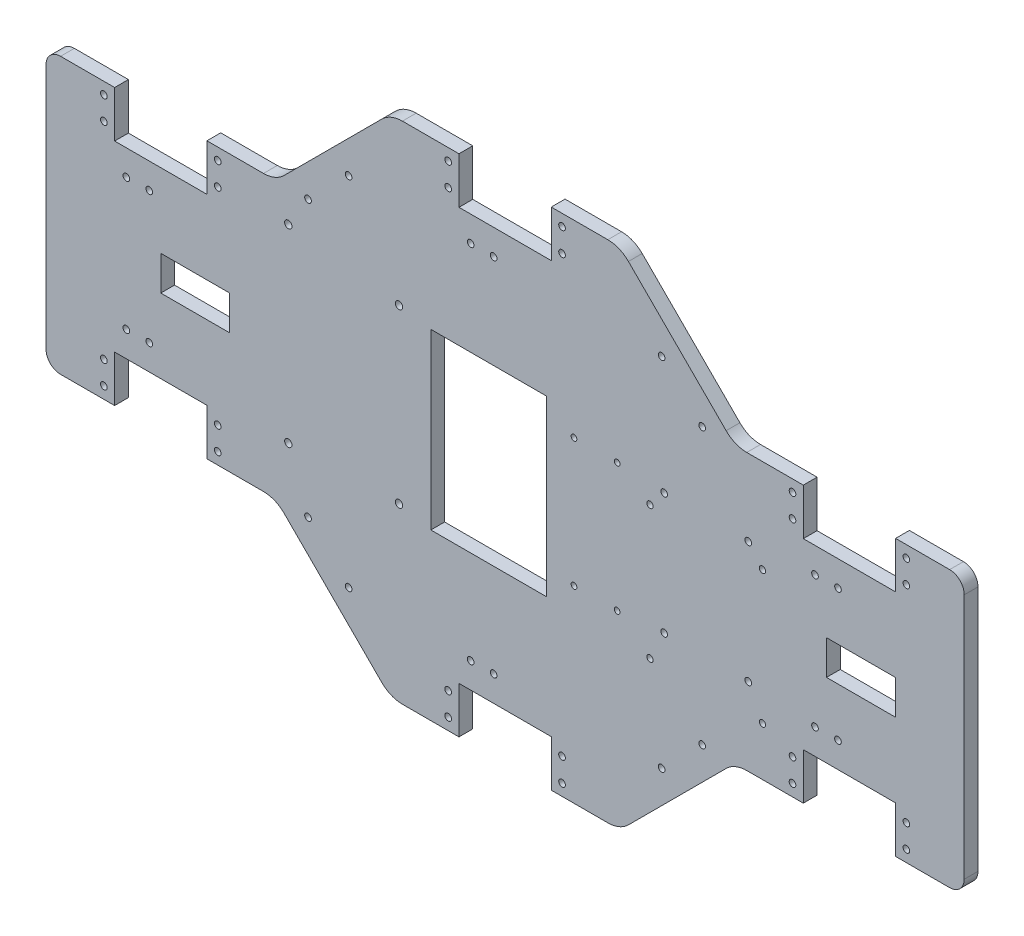
from build123d import *

# Parameters (mm, degrees)
BOSS_EXTRU_1_DEPTH       = 6
ENL_V_MAT_EXTRU_1_REACH  = 416.893
ESQUISSE2_W              = 40.2
ESQUISSE2_H              = 20.2
ENL_V_MAT_EXTRU_2_REACH  = 416.893
ESQUISSE3_R              = 1.45
SKETCH2_W                = 40.2
SKETCH2_H                = 20.2
CUT_EXTRUDE2_DEPTH       = 415.892757228
SKETCH5_R                = 1.45
CUT_EXTRUDE4_DEPTH       = 415.892757228
ESQUISSE4_R              = 1.375
ENL_V_MAT_EXTRU_4_DEPTH  = 415.892757228
ESQUISSE6_R              = 1.45
ENL_V_MAT_EXTRU_6_DEPTH  = 415.892757228
ESQUISSE8_R              = 1.25
ENL_V_MAT_EXTRU_7_DEPTH  = 415.892757228
ESQUISSE9_R              = 1.6
ENL_V_MAT_EXTRU_8_DEPTH  = 415.892757228
ESQUISSE10_W             = 50.45
ESQUISSE10_H             = 75.69
ENL_V_MAT_EXTRU_9_DEPTH  = 415.892757228
ESQUISSE11_W             = 30
ESQUISSE11_H             = 15
ENL_V_MAT_EXTRU_10_DEPTH = 415.892757228
ESQUISSE12_R             = 1.45
ENL_V_MAT_EXTRU_11_DEPTH = 415.892757228
FILLET1_R                = 6.35
FILLET2_R                = 12.7


with BuildPart() as part:
    # Esquisse1 → Boss.-Extru.1 (new body)
    with BuildSketch(Plane.XY):
        Polygon((100, -60), (150, -110), (250, -110), (300, -60), (400, -60), (400, 0), (25.838605695, 0), (0, 0), (0, -60), align=None)
    boss_extru_1 = extrude(amount=BOSS_EXTRU_1_DEPTH)

    # Esquisse2 → Enlèv. mat.-Extru.1 (cut, up to next)
    with BuildSketch(Plane.XY.offset(6), mode=Mode.PRIVATE) as enl_v_mat_extru_1_sk1:
        with Locations((50, -49.9)):
            Rectangle(ESQUISSE2_W, ESQUISSE2_H)
    enl_v_mat_extru_1_tool1 = extrude(enl_v_mat_extru_1_sk1.sketch, amount=-ENL_V_MAT_EXTRU_1_REACH, mode=Mode.PRIVATE) & part.part
    enl_v_mat_extru_1 = enl_v_mat_extru_1_tool1.solids().sort_by_distance((50, -49.9, 6))[0]
    add(enl_v_mat_extru_1, mode=Mode.SUBTRACT)

    # Esquisse3 → Enlèv. mat.-Extru.2 (cut, up to next)
    with BuildSketch(Plane.XY.offset(6), mode=Mode.PRIVATE) as enl_v_mat_extru_2_sk1:
        with Locations((25.2, -54.9)):
            Circle(ESQUISSE3_R)
    enl_v_mat_extru_2_tool1 = extrude(enl_v_mat_extru_2_sk1.sketch, amount=-ENL_V_MAT_EXTRU_2_REACH, mode=Mode.PRIVATE) & part.part
    # Esquisse3 → Enlèv. mat.-Extru.2 (cut, up to next)
    with BuildSketch(Plane.XY.offset(6), mode=Mode.PRIVATE) as enl_v_mat_extru_2_sk2:
        with Locations((74.8, -54.9)):
            Circle(ESQUISSE3_R)
    enl_v_mat_extru_2_tool2 = extrude(enl_v_mat_extru_2_sk2.sketch, amount=-ENL_V_MAT_EXTRU_2_REACH, mode=Mode.PRIVATE) & part.part
    # Esquisse3 → Enlèv. mat.-Extru.2 (cut, up to next)
    with BuildSketch(Plane.XY.offset(6), mode=Mode.PRIVATE) as enl_v_mat_extru_2_sk3:
        with Locations((74.8, -44.9)):
            Circle(ESQUISSE3_R)
    enl_v_mat_extru_2_tool3 = extrude(enl_v_mat_extru_2_sk3.sketch, amount=-ENL_V_MAT_EXTRU_2_REACH, mode=Mode.PRIVATE) & part.part
    # Esquisse3 → Enlèv. mat.-Extru.2 (cut, up to next)
    with BuildSketch(Plane.XY.offset(6), mode=Mode.PRIVATE) as enl_v_mat_extru_2_sk4:
        with Locations((25.2, -44.9)):
            Circle(ESQUISSE3_R)
    enl_v_mat_extru_2_tool4 = extrude(enl_v_mat_extru_2_sk4.sketch, amount=-ENL_V_MAT_EXTRU_2_REACH, mode=Mode.PRIVATE) & part.part
    # Esquisse3 → Enlèv. mat.-Extru.2 (cut, up to next)
    with BuildSketch(Plane.XY.offset(6), mode=Mode.PRIVATE) as enl_v_mat_extru_2_sk5:
        with Locations((35, -28.7)):
            Circle(ESQUISSE3_R)
    enl_v_mat_extru_2_tool5 = extrude(enl_v_mat_extru_2_sk5.sketch, amount=-ENL_V_MAT_EXTRU_2_REACH, mode=Mode.PRIVATE) & part.part
    # Esquisse3 → Enlèv. mat.-Extru.2 (cut, up to next)
    with BuildSketch(Plane.XY.offset(6), mode=Mode.PRIVATE) as enl_v_mat_extru_2_sk6:
        with Locations((45, -28.7)):
            Circle(ESQUISSE3_R)
    enl_v_mat_extru_2_tool6 = extrude(enl_v_mat_extru_2_sk6.sketch, amount=-ENL_V_MAT_EXTRU_2_REACH, mode=Mode.PRIVATE) & part.part
    enl_v_mat_extru_2_1 = enl_v_mat_extru_2_tool1.solids().sort_by_distance((25.2, -54.9, 6))[0]
    add(enl_v_mat_extru_2_1, mode=Mode.SUBTRACT)
    enl_v_mat_extru_2_2 = enl_v_mat_extru_2_tool2.solids().sort_by_distance((74.8, -54.9, 6))[0]
    add(enl_v_mat_extru_2_2, mode=Mode.SUBTRACT)
    enl_v_mat_extru_2_3 = enl_v_mat_extru_2_tool3.solids().sort_by_distance((74.8, -44.9, 6))[0]
    add(enl_v_mat_extru_2_3, mode=Mode.SUBTRACT)
    enl_v_mat_extru_2_4 = enl_v_mat_extru_2_tool4.solids().sort_by_distance((25.2, -44.9, 6))[0]
    add(enl_v_mat_extru_2_4, mode=Mode.SUBTRACT)
    enl_v_mat_extru_2_5 = enl_v_mat_extru_2_tool5.solids().sort_by_distance((35, -28.7, 6))[0]
    add(enl_v_mat_extru_2_5, mode=Mode.SUBTRACT)
    enl_v_mat_extru_2_6 = enl_v_mat_extru_2_tool6.solids().sort_by_distance((45, -28.7, 6))[0]
    add(enl_v_mat_extru_2_6, mode=Mode.SUBTRACT)
    enl_v_mat_extru_2 = enl_v_mat_extru_2_1 + enl_v_mat_extru_2_2 + enl_v_mat_extru_2_3 + enl_v_mat_extru_2_4 + enl_v_mat_extru_2_5 + enl_v_mat_extru_2_6  # Enlèv. mat.-Extru.2 as one shape, for the pattern or mirror that repeats it

    # Sketch2 → Cut-Extrude2 (cut, symmetric)
    with BuildSketch(Plane.XY):
        with Locations((350, -49.9)):
            Rectangle(SKETCH2_W, SKETCH2_H)
        with Locations((200, -99.9)):
            Rectangle(SKETCH2_W, SKETCH2_H)
    cut_extrude2 = extrude(amount=CUT_EXTRUDE2_DEPTH, both=True, mode=Mode.SUBTRACT)

    # Sketch5 → Cut-Extrude4 (cut, through all)
    with BuildSketch(Plane.XY):
        with Locations((175.200064516, -104.9)):
            Circle(SKETCH5_R)
        with Locations((224.8, -104.98)):
            Circle(SKETCH5_R)
        with Locations(Location((224.8, -94.82, 0), (0, 0, 180))):
            Circle(SKETCH5_R)
        with Locations(Location((175.200064516, -94.9, 0), (0, 0, 180))):
            Circle(SKETCH5_R)
        with Locations((325.2, -54.9)):
            Circle(SKETCH5_R)
        with Locations((374.8, -54.9)):
            Circle(SKETCH5_R)
        with Locations(Location((374.8, -44.9, 0), (0, 0, 180))):
            Circle(SKETCH5_R)
        with Locations(Location((325.2, -44.9, 0), (0, 0, 180))):
            Circle(SKETCH5_R)
        with Locations((185.000064516, -78.7)):
            Circle(SKETCH5_R)
        with Locations((195.000064516, -78.7)):
            Circle(SKETCH5_R)
        with Locations((335, -28.7)):
            Circle(SKETCH5_R)
        with Locations((345, -28.7)):
            Circle(SKETCH5_R)
    cut_extrude4 = extrude(amount=CUT_EXTRUDE4_DEPTH, mode=Mode.SUBTRACT)

    # Mirror1: Boss.-Extru.1, Enlèv. mat.-Extru.1, Enlèv. mat.-Extru.2, Cut-Extrude2, Cut-Extrude4 across plane
    add(boss_extru_1.mirror(Plane.ZX))
    add(enl_v_mat_extru_1.mirror(Plane.ZX), mode=Mode.SUBTRACT)
    add(enl_v_mat_extru_2.mirror(Plane.ZX), mode=Mode.SUBTRACT)
    add(cut_extrude2.mirror(Plane.ZX), mode=Mode.SUBTRACT)
    add(cut_extrude4.mirror(Plane.ZX), mode=Mode.SUBTRACT)

    # Esquisse4 → Enlèv. mat.-Extru.4 (cut, through all)
    with BuildSketch(Plane.XY.offset(6)):
        with Locations((263.1, -38.8)):
            Circle(ESQUISSE4_R)
        with Locations((312.1, -38.8)):
            Circle(ESQUISSE4_R)
        with Locations((312.1, 19.2)):
            Circle(ESQUISSE4_R)
        with Locations((263.1, 19.2)):
            Circle(ESQUISSE4_R)
    extrude(amount=-ENL_V_MAT_EXTRU_4_DEPTH, mode=Mode.SUBTRACT)

    # Esquisse6 → Enlèv. mat.-Extru.6 (cut, through all)
    with BuildSketch(Plane(origin=(0, 0, 0), x_dir=(-1, 0, 0), z_dir=(0, 0, -1))):
        with Locations((-269.29, -26.11)):
            Circle(ESQUISSE6_R)
        with Locations((-305.92, -26.11)):
            Circle(ESQUISSE6_R)
        with Locations((-305.92, 26.72)):
            Circle(ESQUISSE6_R)
        with Locations((-269.29, 26.72)):
            Circle(ESQUISSE6_R)
    extrude(amount=-ENL_V_MAT_EXTRU_6_DEPTH, mode=Mode.SUBTRACT)

    # Esquisse8 → Enlèv. mat.-Extru.7 (cut, through all)
    with BuildSketch(Plane(origin=(0, 0, 0), x_dir=(-1, 0, 0), z_dir=(0, 0, -1))):
        with Locations((-230, 27.95)):
            Circle(ESQUISSE8_R)
        with Locations((-248.8, 27.95)):
            Circle(ESQUISSE8_R)
        with Locations((-248.8, -27.95)):
            Circle(ESQUISSE8_R)
        with Locations((-230, -27.95)):
            Circle(ESQUISSE8_R)
    extrude(amount=-ENL_V_MAT_EXTRU_7_DEPTH, mode=Mode.SUBTRACT)

    # Esquisse9 → Enlèv. mat.-Extru.8 (cut, through all)
    with BuildSketch(Plane(origin=(0, 0, 0), x_dir=(-1, 0, 0), z_dir=(0, 0, -1))):
        with Locations((-153.75903462, -35.08)):
            Circle(ESQUISSE9_R)
        with Locations((-105.53903462, -36.31)):
            Circle(ESQUISSE9_R)
        with Locations((-105.53903462, 46.16)):
            Circle(ESQUISSE9_R)
        with Locations((-153.75903462, 39.8)):
            Circle(ESQUISSE9_R)
    extrude(amount=-ENL_V_MAT_EXTRU_8_DEPTH, mode=Mode.SUBTRACT)

    # Esquisse10 → Enlèv. mat.-Extru.9 (cut, through all)
    with BuildSketch(Plane(origin=(0, 0, 0), x_dir=(-1, 0, 0), z_dir=(0, 0, -1))):
        with Locations((-192.875, -0.205)):
            Rectangle(ESQUISSE10_W, ESQUISSE10_H)
    extrude(amount=-ENL_V_MAT_EXTRU_9_DEPTH, mode=Mode.SUBTRACT)

    # Esquisse11 → Enlèv. mat.-Extru.10 (cut, through all)
    with BuildSketch(Plane(origin=(0, 0, 0), x_dir=(-1, 0, 0), z_dir=(0, 0, -1))):
        with Locations((-355, 0)):
            Rectangle(ESQUISSE11_W, ESQUISSE11_H)
        with Locations((-65, 0)):
            Rectangle(ESQUISSE11_W, ESQUISSE11_H)
    extrude(amount=-ENL_V_MAT_EXTRU_10_DEPTH, mode=Mode.SUBTRACT)

    # Esquisse12 → Enlèv. mat.-Extru.11 (cut, through all)
    with BuildSketch(Plane.XY.offset(6)):
        with Locations((131.819805153, 77.67766953)):
            Circle(ESQUISSE12_R)
        with Locations((114.142135624, 60)):
            Circle(ESQUISSE12_R)
        with Locations(Location((285.857864376, 60, 0), (0, 0, 180))):
            Circle(ESQUISSE12_R)
        with Locations(Location((268.180194847, 77.67766953, 0), (0, 0, 180))):
            Circle(ESQUISSE12_R)
        with Locations((285.857864376, -60)):
            Circle(ESQUISSE12_R)
        with Locations((268.180194847, -77.67766953)):
            Circle(ESQUISSE12_R)
        with Locations(Location((131.819805153, -77.67766953, 0), (0, 0, 180))):
            Circle(ESQUISSE12_R)
        with Locations(Location((114.142135624, -60, 0), (0, 0, 180))):
            Circle(ESQUISSE12_R)
    extrude(amount=-ENL_V_MAT_EXTRU_11_DEPTH, mode=Mode.SUBTRACT)

    # Fillet1
    fillet1_edges = [part.edges().sort_by_distance(p)[0] for p in [
        (0, 60, 3),
        (400, 60, 3),
        (0, -60, 3),
        (400, -60, 3),
    ]]
    fillet(fillet1_edges, radius=FILLET1_R)

    # Fillet2
    fillet2_edges = [part.edges().sort_by_distance(p)[0] for p in [
        (100, 60, 3),
        (300, 60, 3),
        (250, 110, 3),
        (150, 110, 3),
        (300, -60, 3),
        (250, -110, 3),
        (150, -110, 3),
        (100, -60, 3),
    ]]
    fillet(fillet2_edges, radius=FILLET2_R)


solid = part.part
